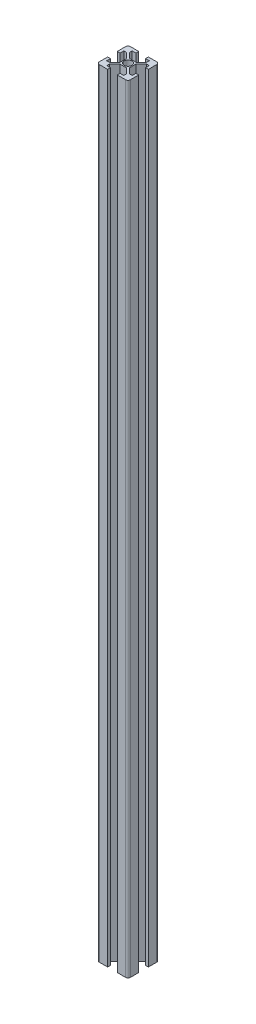
from build123d import *

# Parameters (mm, degrees)
SKETCH_1_R      = 2.5
EXTRUDE_1_DEPTH = 500.23


with BuildPart() as part:
    # 草图1 → 凸台-拉伸1 (new body)
    with BuildSketch(Plane(origin=(0, 0, 0), x_dir=(1, 0, 0), z_dir=(0, 1, 0))):
        with BuildLine():
            Line((-11.732893528, -11.548223653), (-13.532893528, -11.548223653))
            Line((-13.532893528, -11.548223653), (-13.532893528, -16.948223653))
            ThreePointArc((-13.532893528, -16.948223653), (-13.093553699, -18.008883825), (-12.032893528, -18.448223653))
            Line((-12.032893528, -18.448223653), (-6.632893528, -18.448223653))
            Line((-6.632893528, -18.448223653), (-6.632893528, -16.648223653))
            Line((-6.632893528, -16.648223653), (-9.032893528, -16.648223653))
            Line((-9.032893528, -16.648223653), (-9.032893528, -14.845273808))
            Line((-9.032893528, -14.845273808), (-5.735843372, -11.548223653))
            Line((-5.735843372, -11.548223653), (-1.329943683, -11.548223653))
            Line((-1.329943683, -11.548223653), (1.967106472, -14.845273808))
            Line((1.967106472, -14.845273808), (1.967106472, -16.648223653))
            Line((1.967106472, -16.648223653), (-0.432893528, -16.648223653))
            Line((-0.432893528, -16.648223653), (-0.432893528, -18.448223653))
            Line((-0.432893528, -18.448223653), (4.967106472, -18.448223653))
            ThreePointArc((4.967106472, -18.448223653), (6.027766644, -18.008883825), (6.467106472, -16.948223653))
            Line((6.467106472, -16.948223653), (6.467106472, -11.548223653))
            Line((6.467106472, -11.548223653), (4.667106472, -11.548223653))
            Line((4.667106472, -11.548223653), (4.667106472, -13.948223653))
            Line((4.667106472, -13.948223653), (2.864156628, -13.948223653))
            Line((2.864156628, -13.948223653), (-0.478766507, -10.605300518))
            Line((-0.478766507, -10.605300518), (-0.478766507, -6.291146788))
            Line((-0.478766507, -6.291146788), (2.864156628, -2.948223653))
            Line((2.864156628, -2.948223653), (4.667106472, -2.948223653))
            Line((4.667106472, -2.948223653), (4.667106472, -5.348223653))
            Line((4.667106472, -5.348223653), (6.467106472, -5.348223653))
            Line((6.467106472, -5.348223653), (6.467106472, 0.051776347))
            ThreePointArc((6.467106472, 0.051776347), (6.027766644, 1.112436519), (4.967106472, 1.551776347))
            Line((4.967106472, 1.551776347), (-0.432893528, 1.551776347))
            Line((-0.432893528, 1.551776347), (-0.432893528, -0.248223653))
            Line((-0.432893528, -0.248223653), (1.967106472, -0.248223653))
            Line((1.967106472, -0.248223653), (1.967106472, -2.051173498))
            Line((1.967106472, -2.051173498), (-1.329943683, -5.348223653))
            Line((-1.329943683, -5.348223653), (-5.735843372, -5.348223653))
            Line((-5.735843372, -5.348223653), (-9.032893528, -2.051173498))
            Line((-9.032893528, -2.051173498), (-9.032893528, -0.248223653))
            Line((-9.032893528, -0.248223653), (-6.632893528, -0.248223653))
            Line((-6.632893528, -0.248223653), (-6.632893528, 1.551776347))
            Line((-6.632893528, 1.551776347), (-12.032893528, 1.551776347))
            ThreePointArc((-12.032893528, 1.551776347), (-13.093553699, 1.112436519), (-13.532893528, 0.051776347))
            Line((-13.532893528, 0.051776347), (-13.532893528, -5.348223653))
            Line((-13.532893528, -5.348223653), (-11.732893528, -5.348223653))
            Line((-11.732893528, -5.348223653), (-11.732893528, -2.948223653))
            Line((-11.732893528, -2.948223653), (-9.929943683, -2.948223653))
            Line((-9.929943683, -2.948223653), (-6.587020548, -6.291146788))
            Line((-6.587020548, -6.291146788), (-6.587020548, -10.605300518))
            Line((-6.587020548, -10.605300518), (-9.929943683, -13.948223653))
            Line((-9.929943683, -13.948223653), (-11.732893528, -13.948223653))
            Line((-11.732893528, -13.948223653), (-11.732893528, -11.548223653))
        make_face()
        with Locations(Location((-3.532893528, -8.448223653, 0), (0, 0, 270))):
            Circle(SKETCH_1_R, mode=Mode.SUBTRACT)
    extrude(amount=EXTRUDE_1_DEPTH)


solid = part.part
